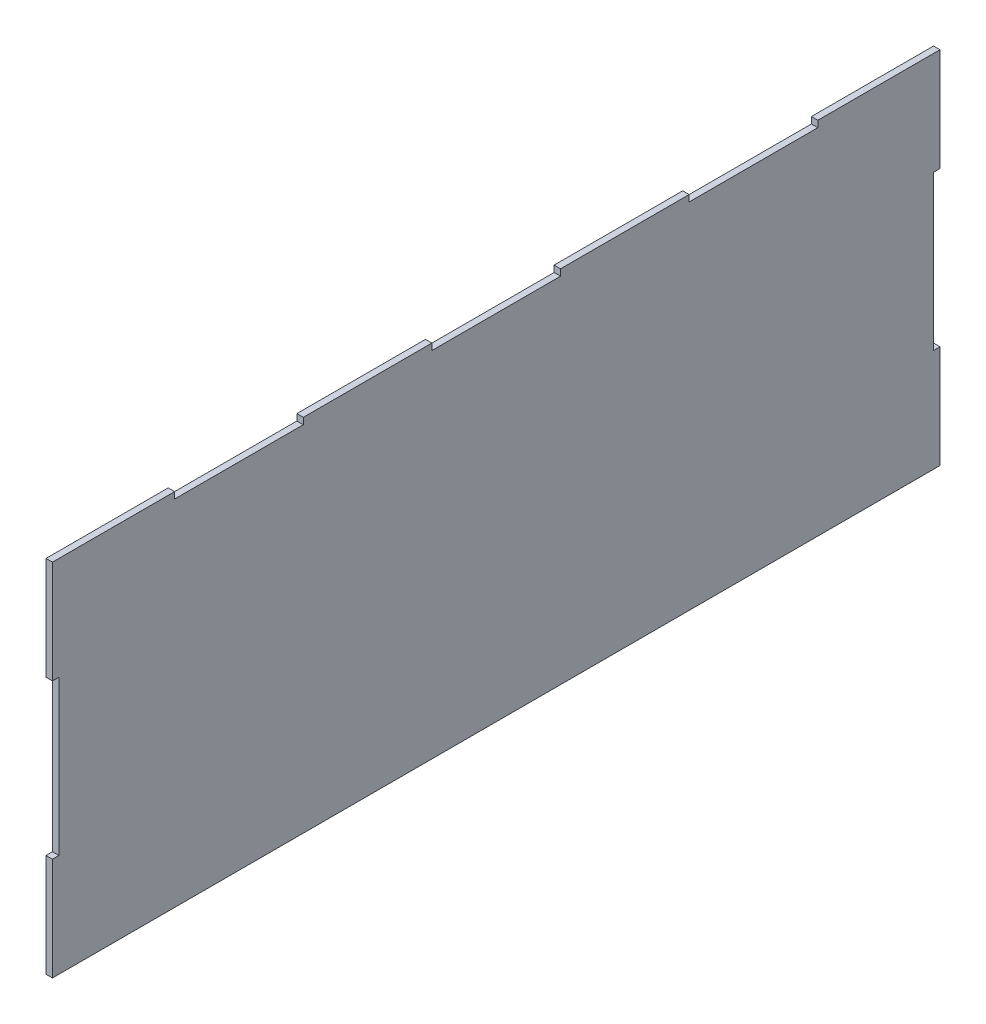
from build123d import *

# Parameters (mm, degrees)
SKIZZE1_W                       = 680
SKIZZE1_H                       = 280
AUFSATZ_LINEAR_AUSTRAGEN1_DEPTH = 5
SKIZZE2_W                       = 5
SKIZZE2_H                       = 80
AUFSATZ_LINEAR_AUSTRAGEN2_DEPTH = 5
SKIZZE3_W                       = 100
SKIZZE3_H                       = 5
SCHNITT_LINEAR_AUSTRAGEN1_DEPTH = 373.357355238


with BuildPart() as part:
    # Skizze1 → Aufsatz-Linear austragen1 (new body)
    with BuildSketch(Plane(origin=(0, 0, 0), x_dir=(0, 0, -1), z_dir=(1, 0, 0))):
        Rectangle(SKIZZE1_W, SKIZZE1_H)
    extrude(amount=AUFSATZ_LINEAR_AUSTRAGEN1_DEPTH)

    # Skizze2 → Aufsatz-Linear austragen2 (add)
    with BuildSketch(Plane(origin=(5, 0, 0), x_dir=(0, 0, -1), z_dir=(1, 0, 0))):
        with Locations((-342.5, 100)):
            Rectangle(SKIZZE2_W, SKIZZE2_H)
        with Locations((-342.5, -100)):
            Rectangle(SKIZZE2_W, SKIZZE2_H)
        with Locations((342.5, -100)):
            Rectangle(SKIZZE2_W, SKIZZE2_H)
        with Locations((342.5, 100)):
            Rectangle(SKIZZE2_W, SKIZZE2_H)
    extrude(amount=-AUFSATZ_LINEAR_AUSTRAGEN2_DEPTH)

    # Skizze3 → Schnitt-Linear austragen1 (cut, through all)
    with BuildSketch(Plane(origin=(5, 0, 0), x_dir=(0, 0, -1), z_dir=(1, 0, 0))):
        with Locations((200, 137.5)):
            Rectangle(SKIZZE3_W, SKIZZE3_H)
        with Locations((-200, 137.5)):
            Rectangle(SKIZZE3_W, SKIZZE3_H)
        with Locations((0, 137.5)):
            Rectangle(SKIZZE3_W, SKIZZE3_H)
    extrude(amount=-SCHNITT_LINEAR_AUSTRAGEN1_DEPTH, mode=Mode.SUBTRACT)


solid = part.part
